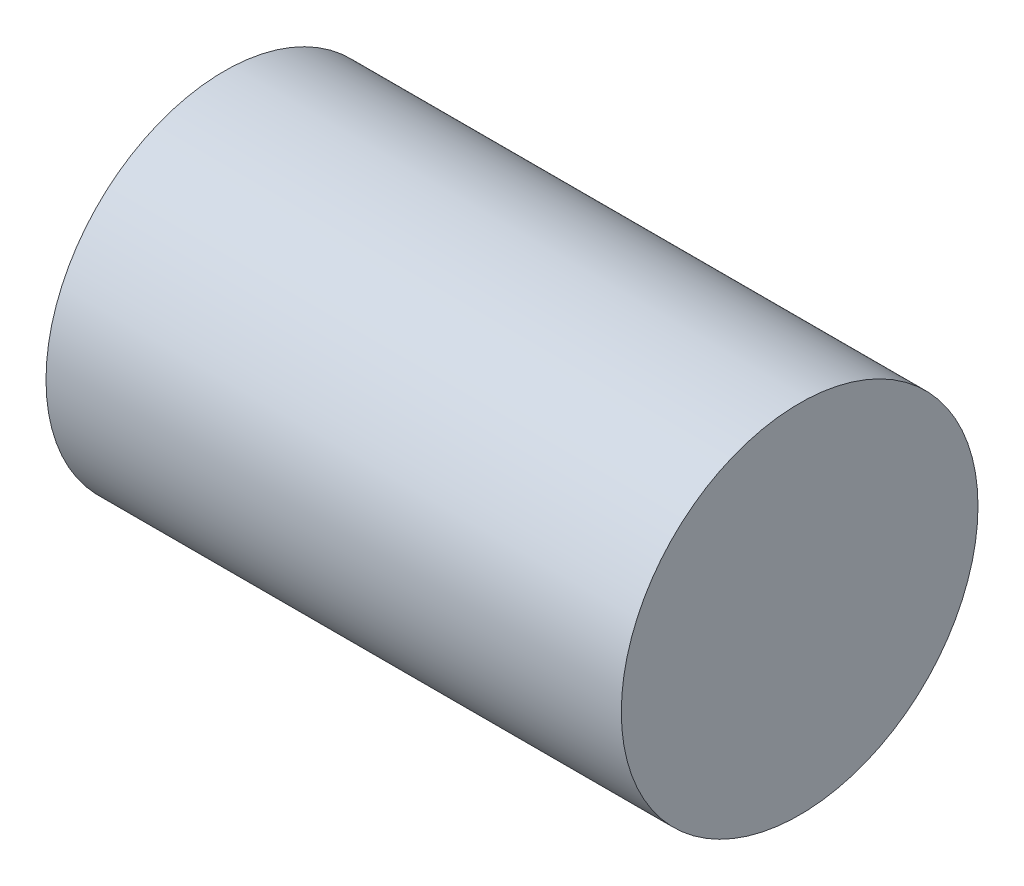
from build123d import *


with BuildPart() as part:
    # Sketch1 → Revolve1 (revolve)
    with BuildSketch(Plane.XY, mode=Mode.PRIVATE) as revolve1_sk:
        Polygon((0, 0), (55, 0), (55, 15.5), (5, 15.5), (5, 5), (0, 5), align=None)
    revolve(revolve1_sk.sketch.rotate(Axis((0, 0, 0), (1, 0, 0)), 90), axis=Axis((0, 0, 0), (1, 0, 0)))


solid = part.part
